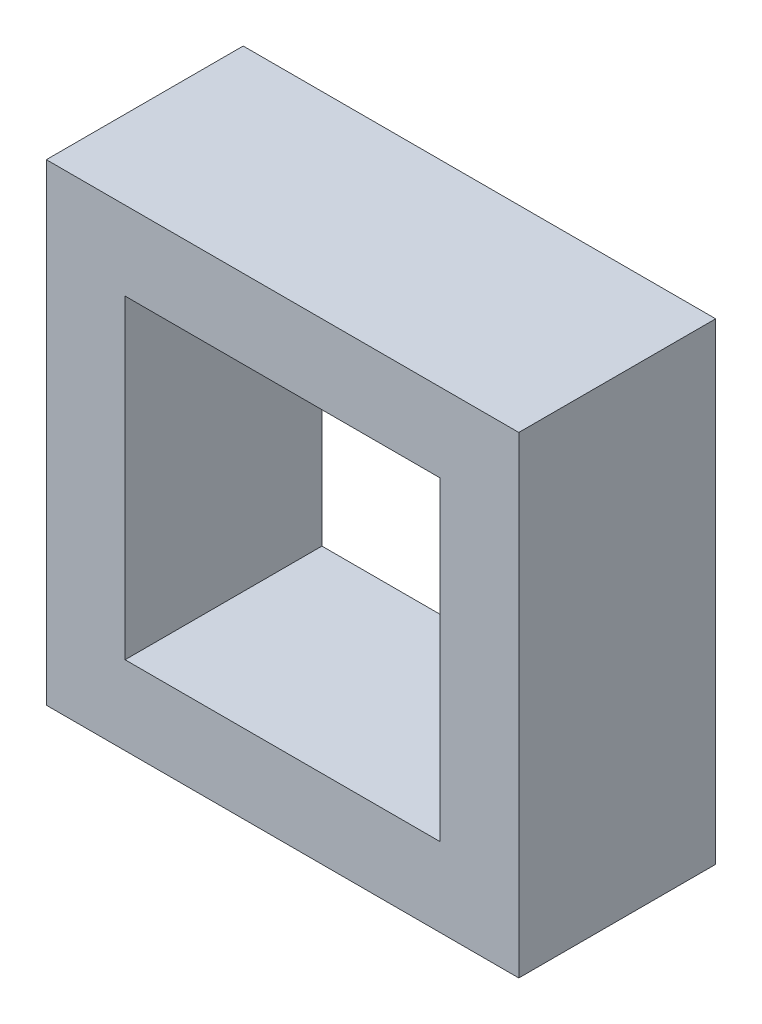
from build123d import *

# Parameters (mm, degrees)
SKETCH1_W           = 24
SKETCH1_H           = 24
SKETCH1_W_2         = 16
SKETCH1_H_2         = 16
BOSS_EXTRUDE1_DEPTH = 5


with BuildPart() as part:
    # Sketch1 → Boss-Extrude1 (new, symmetric)
    with BuildSketch(Plane.XY):
        Rectangle(SKETCH1_W, SKETCH1_H)
        Rectangle(SKETCH1_W_2, SKETCH1_H_2, mode=Mode.SUBTRACT)
    extrude(amount=BOSS_EXTRUDE1_DEPTH, both=True)


solid = part.part
